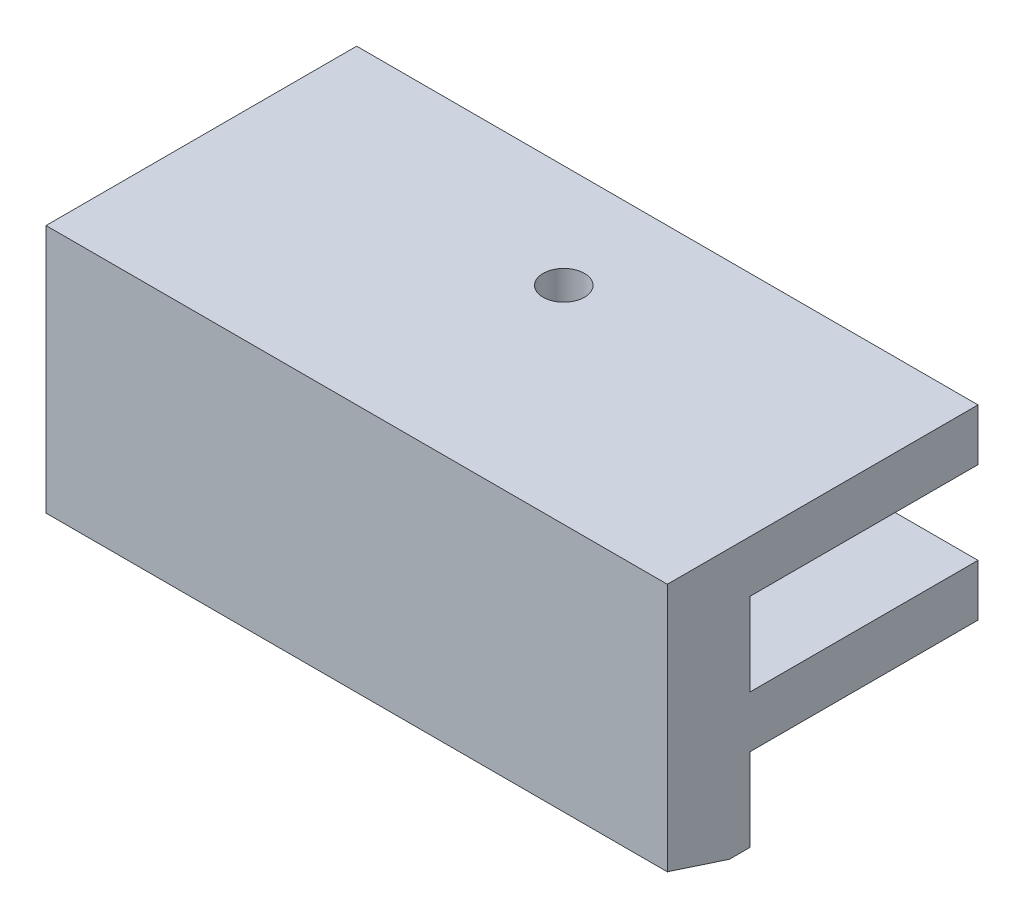
from build123d import *

# Parameters (mm, degrees)
SZKIC2_W                         = 30
SZKIC2_H                         = 15
SZKIC2_R                         = 1
DODANIE_WYCI_GNI_CIE1_DEPTH      = 2.5
DODANIE_WYCI_GNI_CIE2_DEPTH      = 4
DODANIE_WYCI_GNI_CIE2_DEPTH_BACK = 6.5
SZKIC4_W                         = 30
SZKIC4_H                         = 4
SFAZOWANIE1_SIZE                 = 3
SFAZOWANIE1_SIZE2                = 0.974759089


with BuildPart() as part:
    # Szkic2 → Dodanie-wyciągnięcie1 (new body)
    with BuildSketch(Plane(origin=(0, 0, 0), x_dir=(1, 0, 0), z_dir=(0, 1, 0))):
        Rectangle(SZKIC2_W, SZKIC2_H)
        with Locations(Location((0, 2.5, 0), (0, 0, 270))):
            Circle(SZKIC2_R, mode=Mode.SUBTRACT)
    dodanie_wyci_gni_cie1 = extrude(amount=DODANIE_WYCI_GNI_CIE1_DEPTH)

    # Szkic4 → Dodanie-wyciągnięcie2 (add, two sides: drawn at the far end of the back side and taken through both)
    with BuildSketch(Plane(origin=(0, 2.5, 0), x_dir=(1, 0, 0), z_dir=(0, 1, 0)).offset(-DODANIE_WYCI_GNI_CIE2_DEPTH_BACK)):
        with Locations((0, -5.5)):
            Rectangle(SZKIC4_W, SZKIC4_H)
    extrude(amount=DODANIE_WYCI_GNI_CIE2_DEPTH + DODANIE_WYCI_GNI_CIE2_DEPTH_BACK)

    # Lustro3: Dodanie-wyciągnięcie1 across plane
    add(dodanie_wyci_gni_cie1.mirror(Plane.ZX.offset(4.5)))

    # Sfazowanie1
    sfazowanie1_edges = [part.edges().sort_by_distance(p)[0] for p in [
        (0, -4, 7.5),
    ]]
    sfazowanie1_side = [part.faces().sort_by_distance(p)[0] for p in [
        (0, -4, 5.5),
    ]]
    chamfer(sfazowanie1_edges, length=SFAZOWANIE1_SIZE, length2=SFAZOWANIE1_SIZE2, reference=sfazowanie1_side[0])


solid = part.part
